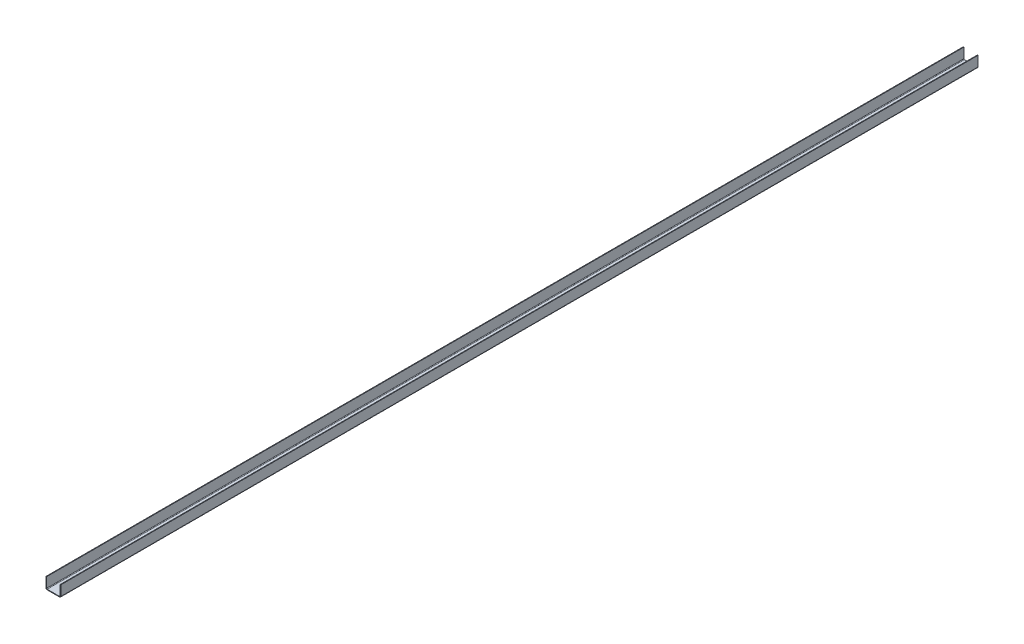
from build123d import *

# Parameters (mm, degrees)
EXTRUDE_THIN1_DEPTH = 2300
SKETCH2_R           = 3.25
CUT_EXTRUDE1_DEPTH  = 10
LPATTERN1_COUNT     = 3
LPATTERN1_PITCH     = 766


with BuildPart() as part:
    # Sketch1 → Extrude-Thin1 (new body)
    with BuildSketch(Plane.XY):
        with BuildLine():
            Line((16.84, 2), (16.84, -23))
            ThreePointArc((16.84, -23), (15.961320344, -25.121320344), (13.84, -26))
            Line((13.84, -26), (-17.16, -26))
            ThreePointArc((-17.16, -26), (-19.281320344, -25.121320344), (-20.16, -23))
            Line((-20.16, -23), (-20.16, 2))
            Line((-20.16, 2), (-18.66, 2))
            Line((-18.66, 2), (-18.66, -23))
            ThreePointArc((-18.66, -23), (-18.220660172, -24.060660172), (-17.16, -24.5))
            Line((-17.16, -24.5), (13.84, -24.5))
            ThreePointArc((13.84, -24.5), (14.900660172, -24.060660172), (15.34, -23))
            Line((15.34, -23), (15.34, 2))
            Line((15.34, 2), (16.84, 2))
        make_face()
    extrude(amount=EXTRUDE_THIN1_DEPTH)

    # Sketch2 → Cut-Extrude1 (cut)
    with BuildSketch(Plane(origin=(0, -24.5, 0), x_dir=(1, 0, 0), z_dir=(0, 1, 0))):
        with Locations(Location((0, -383, 0), (0, 0, 270))):
            Circle(SKETCH2_R)
    cut_extrude1 = extrude(amount=-CUT_EXTRUDE1_DEPTH, mode=Mode.SUBTRACT)

    # LPattern1: Cut-Extrude1 ×3
    with Locations(*[(0, 0, i * LPATTERN1_PITCH) for i in range(1, LPATTERN1_COUNT)]):
        add(cut_extrude1, mode=Mode.SUBTRACT)


solid = part.part
